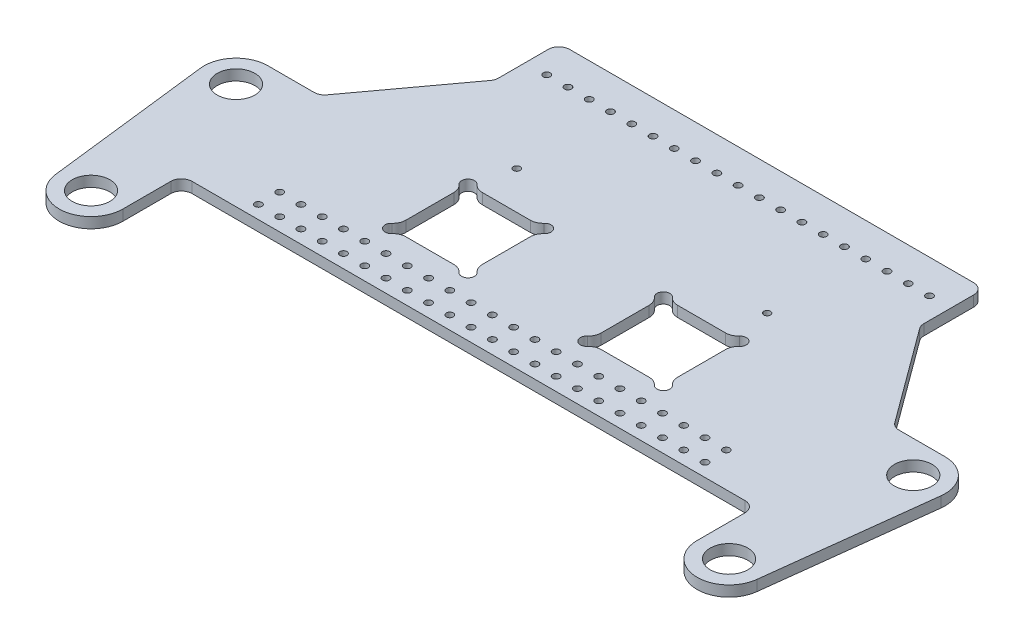
from build123d import *

# Parameters (mm, degrees)
SKETCH1_R            = 1.9939
SKETCH1_R_2          = 11.2395
SKETCH1_R_3          = 14.4145
SKETCH1_R_4          = 2.667
BOSS_EXTRUDE1_DEPTH  = 3.175
SKETCH2_R            = 2.0828
CUT_EXTRUDE1_DEPTH   = 310.212719881
SKETCH7_R            = 2.0828
CUT_EXTRUDE13_DEPTH  = 6.35
FILLET2_R            = 6.35
SKETCH9_R            = 14.4145
SKETCH9_R_2          = 11.2395
BOSS_EXTRUDE2_DEPTH  = 6.35
SKETCH10_W           = 45.72
SKETCH10_H           = 45.72
CUT_EXTRUDE14_DEPTH  = 310.212719881
SKETCH11_R           = 3.81
CUT_EXTRUDE15_DEPTH  = 310.212719881
FILLET3_R            = 7.62
FILLET3_OF_MIRROR2_R = 7.62


with BuildPart() as part:
    # Sketch1 → Boss-Extrude1 (new, symmetric)
    with BuildSketch(Plane(origin=(0, 0, 0), x_dir=(1, 0, 0), z_dir=(0, 1, 0))):
        with BuildLine():
            Line((-127, 215.9), (127, 215.9))
            Line((127, 215.9), (127, 177.8))
            Line((127, 177.8), (171.45, 117.354106062))
            Line((171.45, 117.354106062), (202.217651581, 117.354106062))
            ThreePointArc((202.217651581, 117.354106062), (216.462925903, 110.952214992), (221.133744112, 96.049345906))
            Line((221.133744112, 96.049345906), (209.416092531, -2.254760156))
            ThreePointArc((209.416092531, -2.254760156), (189.370633521, -19.016493666), (171.45, 0))
            Line((171.45, 0), (171.45, 34.925))
            Line((171.45, 34.925), (-171.45, 34.925))
            Line((-171.45, 34.925), (-171.45, 0))
            ThreePointArc((-171.45, 0), (-189.370633521, -19.016493666), (-209.416092531, -2.254760156))
            Line((-209.416092531, -2.254760156), (-221.133744112, 96.049345906))
            ThreePointArc((-221.133744112, 96.049345906), (-216.462925903, 110.952214992), (-202.217651581, 117.354106062))
            Line((-202.217651581, 117.354106062), (-171.45, 117.354106062))
            Line((-171.45, 117.354106062), (-127, 177.8))
            Line((-127, 177.8), (-127, 215.9))
        make_face()
        with Locations(Location((-74.76671991, 138.48842, 0), (0, 0, 270))):
            Circle(SKETCH1_R, mode=Mode.SUBTRACT)
        with Locations(Location((-190.5, 0, 0), (0, 0, 270))):
            Circle(SKETCH1_R_2, mode=Mode.SUBTRACT)
        with Locations(Location((74.76671991, 138.48842, 0), (0, 0, 270))):
            Circle(SKETCH1_R, mode=Mode.SUBTRACT)
        with Locations(Location((190.5, 0, 0), (0, 0, 270))):
            Circle(SKETCH1_R_2, mode=Mode.SUBTRACT)
        with Locations(Location((-202.217651581, 98.304106062, 0), (0, 0, 270))):
            Circle(SKETCH1_R_3, mode=Mode.SUBTRACT)
        with Locations(Location((-76.045897469, 75.2348, 0), (0, 0, 270))):
            Circle(SKETCH1_R_4, mode=Mode.SUBTRACT)
        with Locations(Location((-40.587497469, 110.6932, 0), (0, 0, 270))):
            Circle(SKETCH1_R_4, mode=Mode.SUBTRACT)
        with Locations(Location((40.587497469, 110.6932, 0), (0, 0, 270))):
            Circle(SKETCH1_R_4, mode=Mode.SUBTRACT)
        with Locations(Location((76.045897469, 75.2348, 0), (0, 0, 270))):
            Circle(SKETCH1_R_4, mode=Mode.SUBTRACT)
        with Locations(Location((202.217651581, 98.304106062, 0), (0, 0, 270))):
            Circle(SKETCH1_R_3, mode=Mode.SUBTRACT)
        with Locations(Location((-58.316697469, 92.964, 0), (0, 0, 270))):
            Circle(SKETCH1_R_3, mode=Mode.SUBTRACT)
        with Locations(Location((58.316697469, 92.964, 0), (0, 0, 270))):
            Circle(SKETCH1_R_3, mode=Mode.SUBTRACT)
    extrude(amount=BOSS_EXTRUDE1_DEPTH, both=True)

    # Sketch2 → Cut-Extrude1 (cut, through all)
    with BuildSketch(Plane(origin=(0, 3.175, 0), x_dir=(1, 0, 0), z_dir=(0, 1, 0))):
        with Locations(Location((25.4, 195.904866, 0), (0, 0, 270))):
            Circle(SKETCH2_R)
        with Locations(Location((38.1, 195.904866, 0), (0, 0, 270))):
            Circle(SKETCH2_R)
        with Locations(Location((50.8, 195.904866, 0), (0, 0, 270))):
            Circle(SKETCH2_R)
        with Locations(Location((63.5, 195.904866, 0), (0, 0, 270))):
            Circle(SKETCH2_R)
        with Locations(Location((76.2, 195.904866, 0), (0, 0, 270))):
            Circle(SKETCH2_R)
        with Locations(Location((88.9, 195.904866, 0), (0, 0, 270))):
            Circle(SKETCH2_R)
        with Locations(Location((101.6, 195.904866, 0), (0, 0, 270))):
            Circle(SKETCH2_R)
        with Locations(Location((114.3, 195.904866, 0), (0, 0, 270))):
            Circle(SKETCH2_R)
        with Locations(Location((12.7, 195.904866, 0), (0, 0, 270))):
            Circle(SKETCH2_R)
        with Locations(Location((-12.7, 195.904866, 0), (0, 0, 90))):
            Circle(SKETCH2_R)
        with Locations(Location((-114.3, 195.904866, 0), (0, 0, 90))):
            Circle(SKETCH2_R)
        with Locations(Location((-101.6, 195.904866, 0), (0, 0, 90))):
            Circle(SKETCH2_R)
        with Locations(Location((-88.9, 195.904866, 0), (0, 0, 90))):
            Circle(SKETCH2_R)
        with Locations(Location((-76.2, 195.904866, 0), (0, 0, 90))):
            Circle(SKETCH2_R)
        with Locations(Location((-63.5, 195.904866, 0), (0, 0, 90))):
            Circle(SKETCH2_R)
        with Locations(Location((-50.8, 195.904866, 0), (0, 0, 90))):
            Circle(SKETCH2_R)
        with Locations(Location((-38.1, 195.904866, 0), (0, 0, 90))):
            Circle(SKETCH2_R)
        with Locations(Location((-25.4, 195.904866, 0), (0, 0, 90))):
            Circle(SKETCH2_R)
        with Locations(Location((0, 195.904866, 0), (0, 0, 270))):
            Circle(SKETCH2_R)
    extrude(amount=-CUT_EXTRUDE1_DEPTH, mode=Mode.SUBTRACT)

    # Sketch7 → Cut-Extrude13 (cut)
    with BuildSketch(Plane.XZ.offset(3.175)):
        with Locations(Location((133.35, -42.799, 0), (0, 0, 270))):
            Circle(SKETCH7_R)
        with Locations(Location((-95.25, -55.499, 0), (0, 0, 270))):
            Circle(SKETCH7_R)
        with Locations(Location((-107.95, -42.799, 0), (0, 0, 270))):
            Circle(SKETCH7_R)
        with Locations(Location((-107.95, -55.499, 0), (0, 0, 270))):
            Circle(SKETCH7_R)
        with Locations(Location((-120.65, -42.799, 0), (0, 0, 270))):
            Circle(SKETCH7_R)
        with Locations(Location((-69.85, -55.499, 0), (0, 0, 270))):
            Circle(SKETCH7_R)
        with Locations(Location((-82.55, -42.799, 0), (0, 0, 270))):
            Circle(SKETCH7_R)
        with Locations(Location((-82.55, -55.499, 0), (0, 0, 270))):
            Circle(SKETCH7_R)
        with Locations(Location((-95.25, -42.799, 0), (0, 0, 270))):
            Circle(SKETCH7_R)
        with Locations(Location((-120.65, -55.499, 0), (0, 0, 270))):
            Circle(SKETCH7_R)
        with Locations(Location((-133.35, -42.799, 0), (0, 0, 270))):
            Circle(SKETCH7_R)
        with Locations(Location((-133.35, -55.499, 0), (0, 0, 270))):
            Circle(SKETCH7_R)
        with Locations(Location((57.15, -42.799, 0), (0, 0, 270))):
            Circle(SKETCH7_R)
        with Locations(Location((69.85, -55.499, 0), (0, 0, 270))):
            Circle(SKETCH7_R)
        with Locations(Location((69.85, -42.799, 0), (0, 0, 270))):
            Circle(SKETCH7_R)
        with Locations(Location((82.55, -55.499, 0), (0, 0, 270))):
            Circle(SKETCH7_R)
        with Locations(Location((31.75, -42.799, 0), (0, 0, 270))):
            Circle(SKETCH7_R)
        with Locations(Location((44.45, -55.499, 0), (0, 0, 270))):
            Circle(SKETCH7_R)
        with Locations(Location((44.45, -42.799, 0), (0, 0, 270))):
            Circle(SKETCH7_R)
        with Locations(Location((57.15, -55.499, 0), (0, 0, 270))):
            Circle(SKETCH7_R)
        with Locations(Location((107.95, -42.799, 0), (0, 0, 270))):
            Circle(SKETCH7_R)
        with Locations(Location((120.65, -55.499, 0), (0, 0, 270))):
            Circle(SKETCH7_R)
        with Locations(Location((120.65, -42.799, 0), (0, 0, 270))):
            Circle(SKETCH7_R)
        with Locations(Location((133.35, -55.499, 0), (0, 0, 270))):
            Circle(SKETCH7_R)
        with Locations(Location((82.55, -42.799, 0), (0, 0, 270))):
            Circle(SKETCH7_R)
        with Locations(Location((95.25, -55.499, 0), (0, 0, 270))):
            Circle(SKETCH7_R)
        with Locations(Location((95.25, -42.799, 0), (0, 0, 270))):
            Circle(SKETCH7_R)
        with Locations(Location((107.95, -55.499, 0), (0, 0, 270))):
            Circle(SKETCH7_R)
        with Locations(Location((-44.45, -42.799, 0), (0, 0, 270))):
            Circle(SKETCH7_R)
        with Locations(Location((-31.75, -55.499, 0), (0, 0, 270))):
            Circle(SKETCH7_R)
        with Locations(Location((-31.75, -42.799, 0), (0, 0, 270))):
            Circle(SKETCH7_R)
        with Locations(Location((-19.05, -55.499, 0), (0, 0, 270))):
            Circle(SKETCH7_R)
        with Locations(Location((-69.85, -42.799, 0), (0, 0, 270))):
            Circle(SKETCH7_R)
        with Locations(Location((-57.15, -55.499, 0), (0, 0, 270))):
            Circle(SKETCH7_R)
        with Locations(Location((-57.15, -42.799, 0), (0, 0, 270))):
            Circle(SKETCH7_R)
        with Locations(Location((-44.45, -55.499, 0), (0, 0, 270))):
            Circle(SKETCH7_R)
        with Locations(Location((6.35, -42.799, 0), (0, 0, 270))):
            Circle(SKETCH7_R)
        with Locations(Location((19.05, -55.499, 0), (0, 0, 270))):
            Circle(SKETCH7_R)
        with Locations(Location((19.05, -42.799, 0), (0, 0, 270))):
            Circle(SKETCH7_R)
        with Locations(Location((31.75, -55.499, 0), (0, 0, 270))):
            Circle(SKETCH7_R)
        with Locations(Location((-19.05, -42.799, 0), (0, 0, 270))):
            Circle(SKETCH7_R)
        with Locations(Location((-6.35, -55.499, 0), (0, 0, 270))):
            Circle(SKETCH7_R)
        with Locations(Location((-6.35, -42.799, 0), (0, 0, 270))):
            Circle(SKETCH7_R)
        with Locations(Location((6.35, -55.499, 0), (0, 0, 270))):
            Circle(SKETCH7_R)
    extrude(amount=-CUT_EXTRUDE13_DEPTH, mode=Mode.SUBTRACT)

    # Fillet2
    fillet2_edges = [part.edges().sort_by_distance(p)[0] for p in [
        (171.45, 0, -34.925),
        (-171.45, 0, -34.925),
        (-171.45, 0, -117.354106062),
        (-127, 0, -177.8),
        (-127, 0, -215.9),
        (127, 0, -215.9),
        (127, 0, -177.8),
        (171.45, 0, -117.354106062),
    ]]
    fillet(fillet2_edges, radius=FILLET2_R)

    # Sketch9 → Boss-Extrude2 (add, through all)
    # profile 1 of 2: a face of its own
    with BuildSketch(Plane(origin=(0, 3.175, 0), x_dir=(1, 0, 0), z_dir=(0, 1, 0))):
        with Locations((-202.217651581, 98.304106062)):
            Circle(SKETCH9_R)
        with Locations(Location((-202.217651581, 98.304106062, 0), (0, 0, 270))):
            Circle(SKETCH9_R_2, mode=Mode.SUBTRACT)
    # profile 2 of 2: a face of its own
    with BuildSketch(Plane(origin=(0, 3.175, 0), x_dir=(1, 0, 0), z_dir=(0, 1, 0))):
        with Locations((202.217651581, 98.304106062)):
            Circle(SKETCH9_R)
        with Locations(Location((202.217651581, 98.304106062, 0), (0, 0, 270))):
            Circle(SKETCH9_R_2, mode=Mode.SUBTRACT)
    extrude(amount=-BOSS_EXTRUDE2_DEPTH)

    # Sketch10 → Cut-Extrude14 (cut, symmetric)
    with BuildSketch(Plane(origin=(0, 3.175, 0), x_dir=(1, 0, 0), z_dir=(0, 1, 0))):
        with Locations((-58.316697469, 92.964)):
            Rectangle(SKETCH10_W, SKETCH10_H)
    cut_extrude14 = extrude(amount=CUT_EXTRUDE14_DEPTH, both=True, mode=Mode.SUBTRACT)

    # Sketch11 → Cut-Extrude15 (cut, symmetric)
    with BuildSketch(Plane(origin=(0, 3.175, 0), x_dir=(1, 0, 0), z_dir=(0, 1, 0))):
        with Locations((-81.176697469, 115.824)):
            Circle(SKETCH11_R)
        with Locations((-35.456697469, 115.824)):
            Circle(SKETCH11_R)
        with Locations((-81.176697469, 70.104)):
            Circle(SKETCH11_R)
        with Locations((-35.456697469, 70.104)):
            Circle(SKETCH11_R)
    cut_extrude15 = extrude(amount=CUT_EXTRUDE15_DEPTH, both=True, mode=Mode.SUBTRACT)

    # Fillet3
    fillet3_edges = [part.edges().sort_by_distance(p)[0] for p in [
        (-77.366697469, 0, -115.824),
        (-39.266697469, 0, -115.824),
        (-81.176697469, 0, -73.914),
        (-39.266697469, 0, -70.104),
        (-35.456697469, 0, -112.014),
        (-77.366697469, 0, -70.104),
        (-35.456697469, 0, -73.914),
        (-81.176697469, 0, -112.014),
    ]]
    fillet(fillet3_edges, radius=FILLET3_R)

    # Mirror2: Cut-Extrude14, Cut-Extrude15 across plane
    add(cut_extrude14.mirror(Plane.ZY), mode=Mode.SUBTRACT)
    add(cut_extrude15.mirror(Plane.ZY), mode=Mode.SUBTRACT)

    # Fillet3 of Mirror2
    fillet3_of_mirror2_edges = [part.edges().sort_by_distance(p)[0] for p in [
        (77.366697469, 0, -115.824),
        (39.266697469, 0, -115.824),
        (81.176697469, 0, -73.914),
        (39.266697469, 0, -70.104),
        (35.456697469, 0, -112.014),
        (77.366697469, 0, -70.104),
        (35.456697469, 0, -73.914),
        (81.176697469, 0, -112.014),
    ]]
    fillet(fillet3_of_mirror2_edges, radius=FILLET3_OF_MIRROR2_R)


solid = part.part
